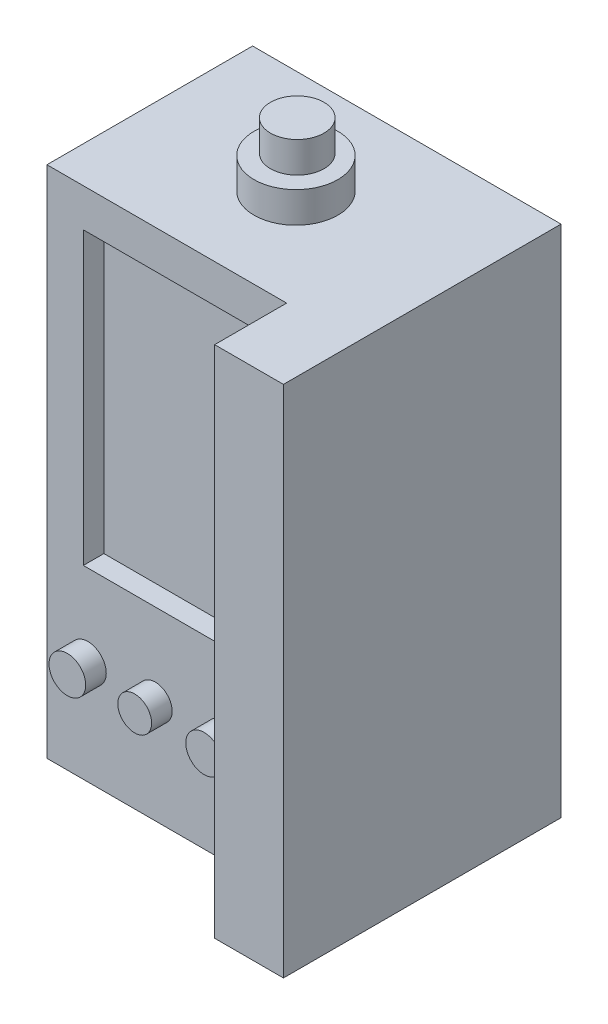
from build123d import *

# Parameters (mm, degrees)
SKETCH1_W           = 30
SKETCH1_H           = 50
BOSS_EXTRUDE1_DEPTH = 20
SKETCH2_W           = 17.590174706
SKETCH2_H           = 28.27201044
CUT_EXTRUDE1_DEPTH  = 2
BOSS_EXTRUDE2_DEPTH = 7
SKETCH4_R           = 1.783397986
SKETCH4_R_2         = 1.644242452
SKETCH4_R_3         = 1.78177715
BOSS_EXTRUDE3_DEPTH = 2
SKETCH5_R           = 4.074369341
BOSS_EXTRUDE4_DEPTH = 3
SKETCH6_R           = 2.60170509
BOSS_EXTRUDE5_DEPTH = 3
SCALE1_SCALE        = 0.7


with BuildPart() as part:
    # Sketch1 → Boss-Extrude1 (new body)
    with BuildSketch(Plane.XY):
        with Locations((-13.575598108, 16.077578101)):
            Rectangle(SKETCH1_W, SKETCH1_H)
    extrude(amount=BOSS_EXTRUDE1_DEPTH)

    # Sketch2 → Cut-Extrude1 (cut)
    with BuildSketch(Plane.XY.offset(20)):
        with Locations((-16.242560835, 23.231182823)):
            Rectangle(SKETCH2_W, SKETCH2_H)
    extrude(amount=-CUT_EXTRUDE1_DEPTH, mode=Mode.SUBTRACT)

    # Sketch3 → Boss-Extrude2 (add)
    with BuildSketch(Plane.XY.offset(20)):
        Polygon((-4.548684079, 41.077578101), (-5.266390414, 41.077578101), (-5.266390414, -8.922421899), (1.424401892, -8.922421899), (1.424401892, 41.077578101), align=None)
    extrude(amount=BOSS_EXTRUDE2_DEPTH)

    # Sketch4 → Boss-Extrude3 (add)
    with BuildSketch(Plane.XY.offset(20)):
        with Locations((-24.591340484, 1.128947628)):
            Circle(SKETCH4_R)
        with Locations((-18.041639174, 1.128947628)):
            Circle(SKETCH4_R_2)
        with Locations((-11.291658509, 1.128947628)):
            Circle(SKETCH4_R_3)
    extrude(amount=BOSS_EXTRUDE3_DEPTH)

    # Sketch5 → Boss-Extrude4 (add)
    with BuildSketch(Plane(origin=(0, 41.077578101, 0), x_dir=(1, 0, 0), z_dir=(0, 1, 0))):
        with Locations(Location((-14.24940876, -10.110216384, 0), (0, 0, 270))):
            Circle(SKETCH5_R)
    extrude(amount=BOSS_EXTRUDE4_DEPTH)

    # Sketch6 → Boss-Extrude5 (add)
    with BuildSketch(Plane(origin=(0, 44.077578101, 0), x_dir=(1, 0, 0), z_dir=(0, 1, 0))):
        with Locations(Location((-14.364915038, -9.868044196, 0), (0, 0, 270))):
            Circle(SKETCH6_R)
    extrude(amount=BOSS_EXTRUDE5_DEPTH)


with BuildPart() as part_1:
    # Scale1: scaled about (-12.641542426, 16.016298643, 10.736690586)
    add(part.part.scale(SCALE1_SCALE).moved(Location((-3.792462728, 4.804889593, 3.221007176))))


solid = part_1.part
